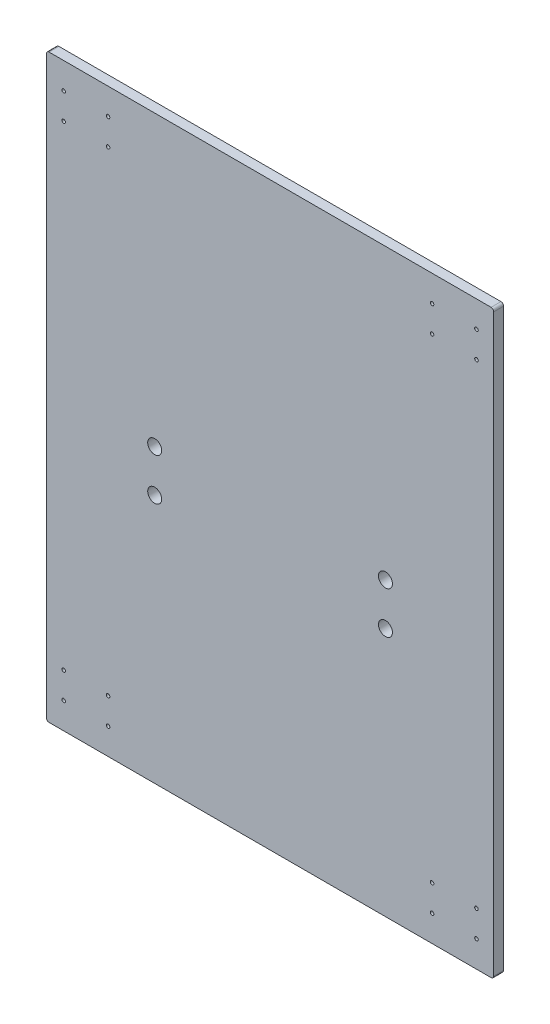
from build123d import *

# Parameters (mm, degrees)
SKETCH1_W               = 431.8
SKETCH1_H               = 560.3875
BOSS_EXTRUDE1_DEPTH     = 9.525
FILLET1_R               = 2.54
F_1_2_CLEARANCE_HOLE1_D = 13.49248
F_5_CLEARANCE_HOLE1_D   = 3.4544


with BuildPart() as part:
    # Sketch1 → Boss-Extrude1 (new body)
    with BuildSketch(Plane.XY):
        with Locations((177.8, -242.09375)):
            Rectangle(SKETCH1_W, SKETCH1_H)
    extrude(amount=BOSS_EXTRUDE1_DEPTH)

    # Fillet1
    fillet1_edges = [part.edges().sort_by_distance(p)[0] for p in [
        (-38.1, 38.1, 4.7625),
        (393.7, 38.1, 4.7625),
        (393.7, -522.2875, 4.7625),
        (-38.1, -522.2875, 4.7625),
    ]]
    fillet(fillet1_edges, radius=FILLET1_R)

    # 1/2 Clearance Hole1 (through all)
    with Locations(Plane(origin=(0, 0, 0), x_dir=(-1, 0, 0), z_dir=(0, 0, -1))):
        with Locations((-66.42862, -240.74374), (-289.17138, -240.74374), (-289.17138, -281.38374), (-66.42862, -281.38374)):
            Hole(F_1_2_CLEARANCE_HOLE1_D / 2)

    # #5 Clearance Hole1 (through all)
    with Locations(Plane(origin=(0, 0, 0), x_dir=(-1, 0, 0), z_dir=(0, 0, -1))):
        with Locations((-377.0376, 12.7), (-377.0376, -12.7), (-334.1624, 12.7), (-334.1624, -12.7), (-21.4376, -12.7), (21.4376, -12.7), (21.4376, 12.7), (-21.4376, 12.7), (-21.4376, -496.8875), (21.4376, -496.8875), (21.4376, -471.4875), (-21.4376, -471.4875), (-334.1624, -471.4875), (-334.1624, -496.8875), (-377.0376, -471.4875), (-377.0376, -496.8875)):
            Hole(F_5_CLEARANCE_HOLE1_D / 2)


solid = part.part
